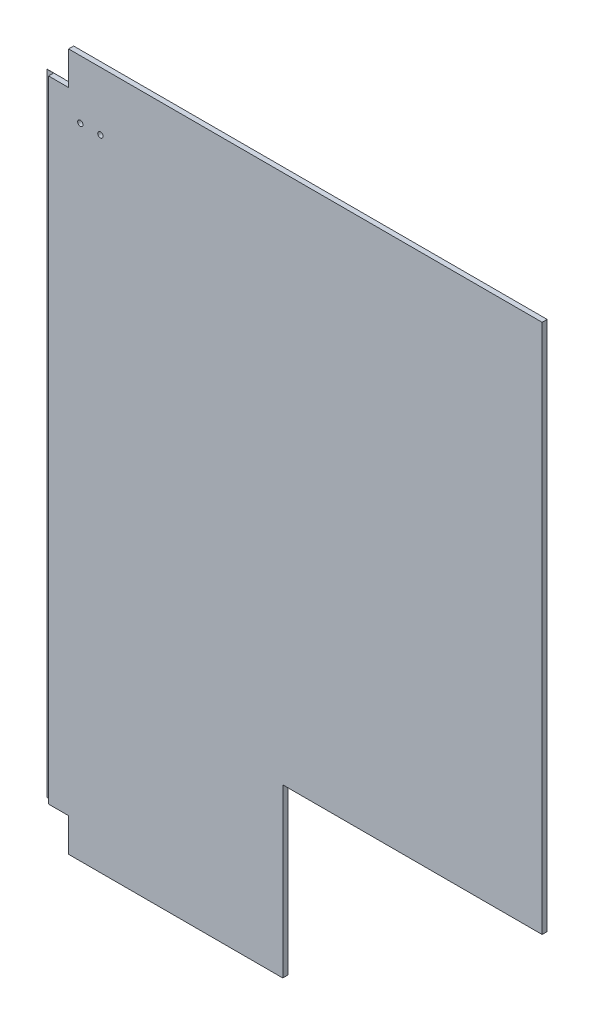
from build123d import *

# Parameters (mm, degrees)
BOSS_EXTRUDE1_DEPTH           = 3
SKETCH2_W                     = 10
SKETCH2_H                     = 416.9
BOSS_EXTRUDE2_DEPTH           = 0.1
CUT_EXTRUDE1_DEPTH            = 10
SKETCH5_W                     = 1.6
SKETCH5_H                     = 3.1
M3_CLEARANCE_HOLE1_AT_2_COUNT = 2
M3_CLEARANCE_HOLE1_AT_2_PITCH = 12
SKETCH6_W                     = 5
SKETCH6_H                     = 316.9
CUT_EXTRUDE2_DEPTH            = 10


with BuildPart() as part:
    # Sketch1 → Boss-Extrude1 (new body)
    with BuildSketch(Plane.XY):
        Polygon((0, 0), (140, 0), (140, 100), (300, 100), (300, 416.9), (0, 416.9), align=None)
    extrude(amount=BOSS_EXTRUDE1_DEPTH)


with BuildPart() as body_2:
    # Sketch2 → Boss-Extrude2 (new body)
    with BuildSketch(Plane.XY):
        with Locations((1, 208.45)):
            Rectangle(SKETCH2_W, SKETCH2_H)
    extrude(amount=-BOSS_EXTRUDE2_DEPTH)


with BuildPart() as cut_extrude1_tool:
    # Sketch3 → Cut-Extrude1 (new body)
    with BuildSketch(Plane.XY.offset(3)):
        Polygon((0, 416.9), (-4, 416.9), (-4, 396.9), (0, 396.9), (12, 396.9), (12, 416.9), align=None)
        Polygon((0, 0), (12, 0), (12, 20), (0, 20), (-4, 20), (-4, 0), align=None)
    extrude(amount=-CUT_EXTRUDE1_DEPTH)


with BuildPart() as part_1:
    add(part.part)

    # Cut-Extrude1: cut by cut_extrude1_tool
    add(cut_extrude1_tool.part, mode=Mode.SUBTRACT)

    # Sketch5 → M3 Clearance Hole1 (revolve, cut)
    with BuildSketch(Plane(origin=(31, 381.9, 3), x_dir=(0, -1, 0), z_dir=(1, 0, 0))):
        with Locations((0.8, 1.55)):
            Rectangle(SKETCH5_W, SKETCH5_H)
    m3_clearance_hole1 = revolve(axis=Axis((31, 381.9, 9.35), (0, 0, -1)), mode=Mode.SUBTRACT)

    # M3 Clearance Hole1 at 2: M3 Clearance Hole1 ×2
    with Locations(*[(-i * M3_CLEARANCE_HOLE1_AT_2_PITCH, 0, 0) for i in range(1, M3_CLEARANCE_HOLE1_AT_2_COUNT)]):
        add(m3_clearance_hole1, mode=Mode.SUBTRACT)

    # Sketch6 → Cut-Extrude2 (cut)
    with BuildSketch(Plane.XY.offset(3)):
        with Locations((297.5, 258.45)):
            Rectangle(SKETCH6_W, SKETCH6_H)
    extrude(amount=-CUT_EXTRUDE2_DEPTH, mode=Mode.SUBTRACT)


with BuildPart() as body_2_1:
    add(body_2.part)

    # Cut-Extrude1: cut by cut_extrude1_tool
    add(cut_extrude1_tool.part, mode=Mode.SUBTRACT)


solid = Compound([part_1.part, body_2_1.part])
